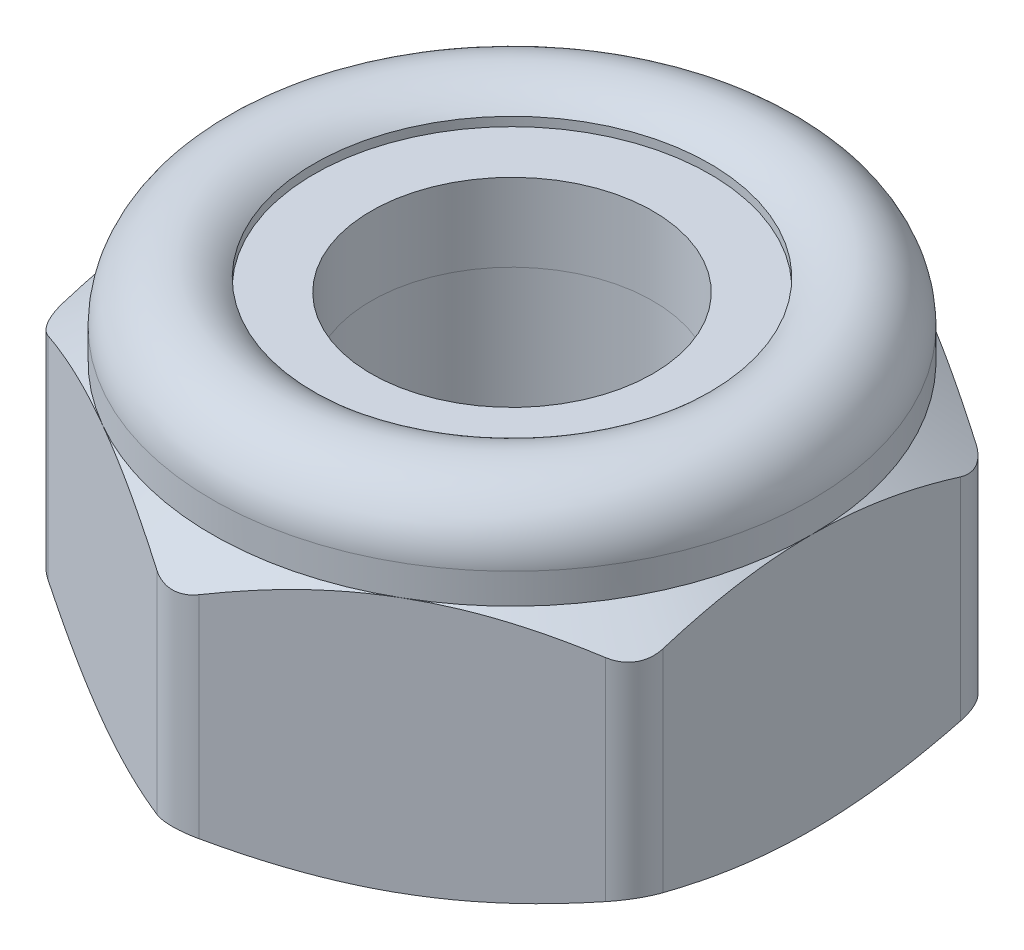
from build123d import *

# Parameters (mm, degrees)
BOSS_EXTRUDE1_DEPTH      = 3
BOSS_EXTRUDE1_DEPTH_BACK = 3
SKETCH2_R                = 2.350480947
FILLET1_R                = 0.7
SKETCH12_W               = 0.704163056
SKETCH12_H               = 1.358326112
SKETCH4_W                = 1.653682109
SKETCH4_H                = 1.298326112


with BuildPart() as part:
    # Sketch2 → Boss-Extrude1 (new, two sides: drawn at the far end of the back side and taken through both)
    with BuildSketch(Plane(origin=(0, 0, 0), x_dir=(1, 0, 0), z_dir=(0, 1, 0)).offset(-BOSS_EXTRUDE1_DEPTH_BACK)):
        Polygon((0, 5.773502692), (-5, 2.886751346), (-5, -2.886751346), (0, -5.773502692), (5, -2.886751346), (5, 2.886751346), align=None)
        with Locations(Location((0, 0, 0), (0, 0, 270))):
            Circle(SKETCH2_R, mode=Mode.SUBTRACT)
    extrude(amount=BOSS_EXTRUDE1_DEPTH + BOSS_EXTRUDE1_DEPTH_BACK)

    # Fillet1
    fillet1_edges = [part.edges().sort_by_distance(p)[0] for p in [
        (5, 0, -2.886751346),
        (5, 0, 2.886751346),
        (0, 0, 5.773502692),
        (-5, 0, 2.886751346),
        (-5, 0, -2.886751346),
        (0, 0, -5.773502692),
    ]]
    fillet(fillet1_edges, radius=FILLET1_R)

    # Sketch3 → Cut-Revolve2 (revolve, cut)
    with BuildSketch(Plane(origin=(0, 0, 0), x_dir=(0, 0, -1), z_dir=(1, 0, 0)), mode=Mode.PRIVATE) as cut_revolve2_sk:
        with BuildLine():
            Line((5.773502692, 1.5), (5.773502692, 4))
            Line((5.773502692, 4), (2.350480947, 4))
            Line((2.350480947, 4), (2.350480947, 1.2))
            Line((2.350480947, 1.2), (3.3, 1.2))
            Line((3.3, 1.2), (3.3, 2.708326112))
            ThreePointArc((3.3, 2.708326112), (4.385253356, 2.924196426), (5, 2.004163056))
            Line((5, 2.004163056), (5, 1.5))
            Line((5, 1.5), (5.773502692, 0.958387584))
            Line((5.773502692, 0.958387584), (5.773502692, 1.5))
        make_face()
        Polygon((4.6, -3), (5.773502692, -2.322477905), (5.773502692, -3), align=None)
        Polygon((2.350480947, -3), (2.350480947, -2.4), (2.950480947, -3), align=None)
    revolve(cut_revolve2_sk.sketch.rotate(Axis((0, -3, 0), (0, 1, 0)), 270), axis=Axis((0, -3, 0), (0, 1, 0)), mode=Mode.SUBTRACT)

    # Sketch12 → Cut-Revolve3 (revolve, cut)
    with BuildSketch(Plane(origin=(0, 0, 0), x_dir=(0, 0, -1), z_dir=(1, 0, 0)), mode=Mode.PRIVATE) as cut_revolve3_sk:
        with Locations((3.652081528, 1.879163056)):
            Rectangle(SKETCH12_W, SKETCH12_H)
    revolve(cut_revolve3_sk.sketch.rotate(Axis((0, 3, 0), (0, -1, 0)), 90), axis=Axis((0, 3, 0), (0, -1, 0)), mode=Mode.SUBTRACT)


with BuildPart() as body_2:
    # Sketch4 → Revolve1 (revolve)
    with BuildSketch(Plane(origin=(0, 0, 0), x_dir=(0, 0, -1), z_dir=(1, 0, 0)), mode=Mode.PRIVATE) as revolve1_sk:
        with Locations((3.177322002, 1.849163056)):
            Rectangle(SKETCH4_W, SKETCH4_H)
    revolve(revolve1_sk.sketch.rotate(Axis((0, -3, 0), (0, 1, 0)), 270), axis=Axis((0, -3, 0), (0, 1, 0)))


solid = Compound([part.part, body_2.part])
